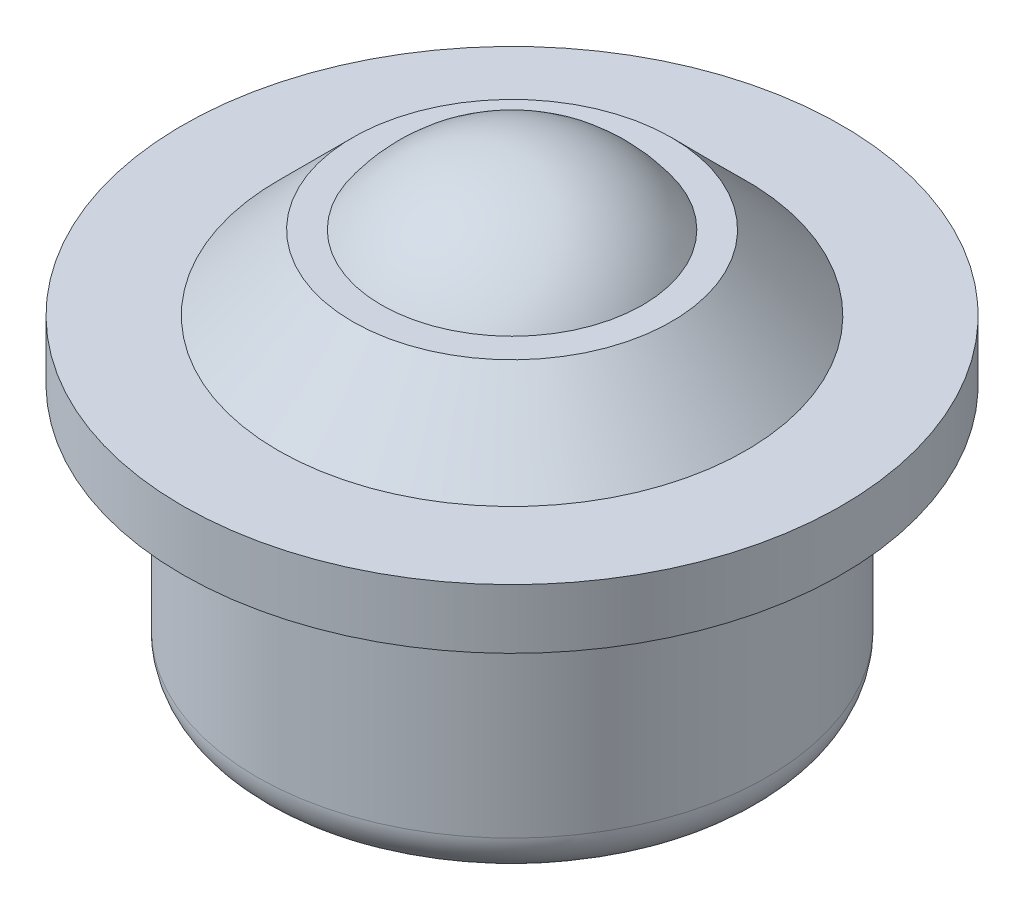
from build123d import *


with BuildPart() as part:
    # Esquisse1 → Révolution1 (revolve)
    with BuildSketch(Plane.XY, mode=Mode.PRIVATE) as r_volution1_sk:
        with BuildLine():
            Line((-12, -2), (-15.5, -2))
            Line((-15.5, -2), (-15.5, 0.8))
            Line((-15.5, 0.8), (-11, 0.8))
            Line((-11, 0.8), (-7.5, 4.3))
            Line((-7.5, 4.3), (-6.144916598, 4.3))
            ThreePointArc((-6.144916598, 4.3), (-3.464101615, 6.652067348), (0, 7.5))
            Line((0, 7.5), (0, -14))
            ThreePointArc((0, -14), (-3.070175628, -13.659210139), (-5.990882009, -12.653431659))
            ThreePointArc((-5.990882009, -12.653431659), (-7.30840287, -12.515081442), (-8.423361148, -13.230532377))
            ThreePointArc((-8.423361148, -13.230532377), (-10.650662084, -13.891200373), (-12, -12))
            Line((-12, -12), (-12, -2))
        make_face()
    revolve(r_volution1_sk.sketch.rotate(Axis((0, 7.5, 0), (0, -1, 0)), 270), axis=Axis((0, 7.5, 0), (0, -1, 0)))


solid = part.part
